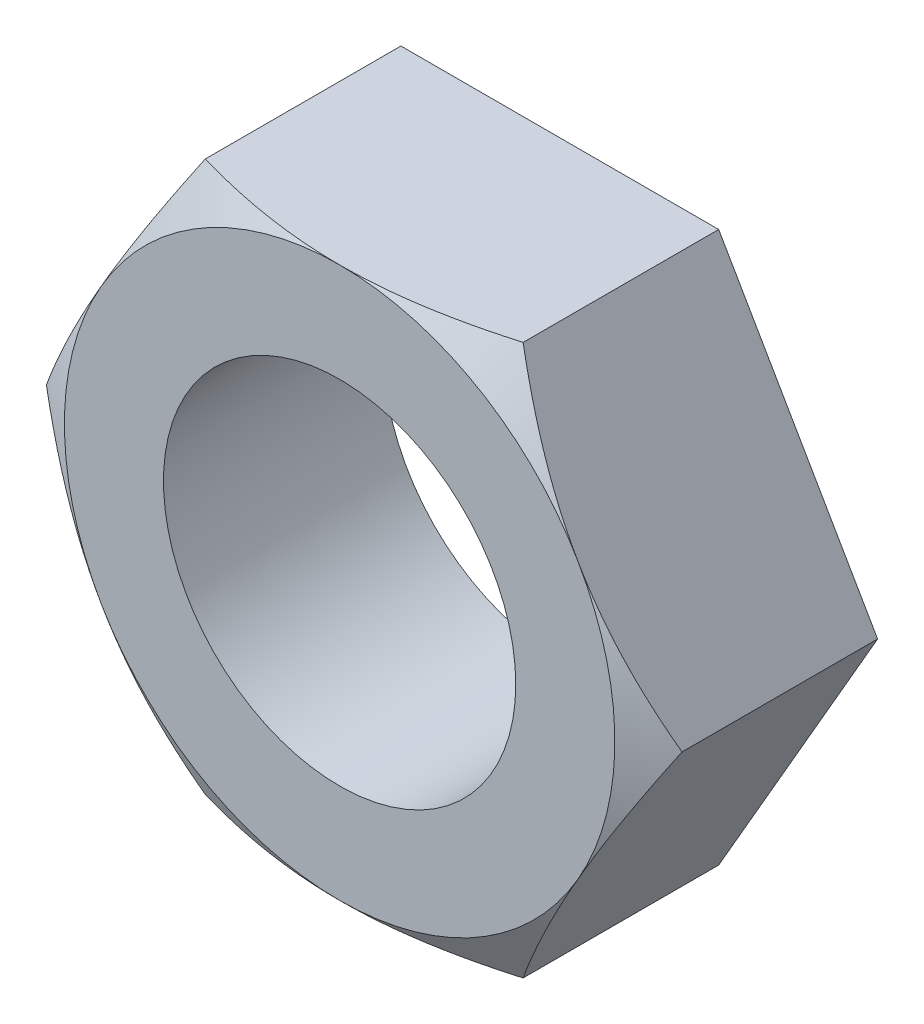
from build123d import *

# Parameters (mm, degrees)
Y_KSEKLIK_EKSTR_ZYON1_DEPTH = 10
IZIM2_R                     = 8
KES_EKSTR_ZYON1_DEPTH       = 10
IZIM3_OUTSIDE_W             = 73.404
IZIM3_OUTSIDE_H             = 69.536
IZIM3_OUTSIDE_R             = 12.5
KES_EKSTR_ZYON2_DEPTH       = 10
KES_EKSTR_ZYON2_DRAFT       = -60


with BuildPart() as part:
    # Çizim1 → Yükseklik-Ekstrüzyon1 (new body)
    with BuildSketch(Plane.XY):
        Polygon((14.43375673, 0), (7.216878365, 12.5), (-7.216878365, 12.5), (-14.43375673, 0), (-7.216878365, -12.5), (7.216878365, -12.5), align=None)
    extrude(amount=Y_KSEKLIK_EKSTR_ZYON1_DEPTH)

    # Çizim2 → Kes-Ekstrüzyon1 (cut)
    with BuildSketch(Plane.XY.offset(10)):
        Circle(IZIM2_R)
    extrude(amount=-KES_EKSTR_ZYON1_DEPTH, mode=Mode.SUBTRACT)


with BuildPart() as kes_ekstr_zyon2_tool:
    # Çizim3 outside → Kes-Ekstrüzyon2 (with draft: the straight prism first)
    with BuildSketch(Plane.XY.offset(10)):
        Rectangle(IZIM3_OUTSIDE_W, IZIM3_OUTSIDE_H)
        Circle(IZIM3_OUTSIDE_R, mode=Mode.SUBTRACT)
    extrude(amount=-KES_EKSTR_ZYON2_DEPTH)
    # Kes-Ekstrüzyon2: the draft: its side faces are tilted about the plane it starts from
    kes_ekstr_zyon2_sides = [kes_ekstr_zyon2_tool.faces().sort_by_distance(p)[0] for p in [
        (0, -34.768, 5),
        (36.702, 0, 5),
        (0, 34.768, 5),
        (-36.702, 0, 5),
        (-12.5, 0, 5),
    ]]
    draft(kes_ekstr_zyon2_sides, Plane.XY.offset(10), KES_EKSTR_ZYON2_DRAFT)


with BuildPart() as part_1:
    add(part.part)

    # Kes-Ekstrüzyon2: cut by kes_ekstr_zyon2_tool
    add(kes_ekstr_zyon2_tool.part, mode=Mode.SUBTRACT)


solid = part_1.part
